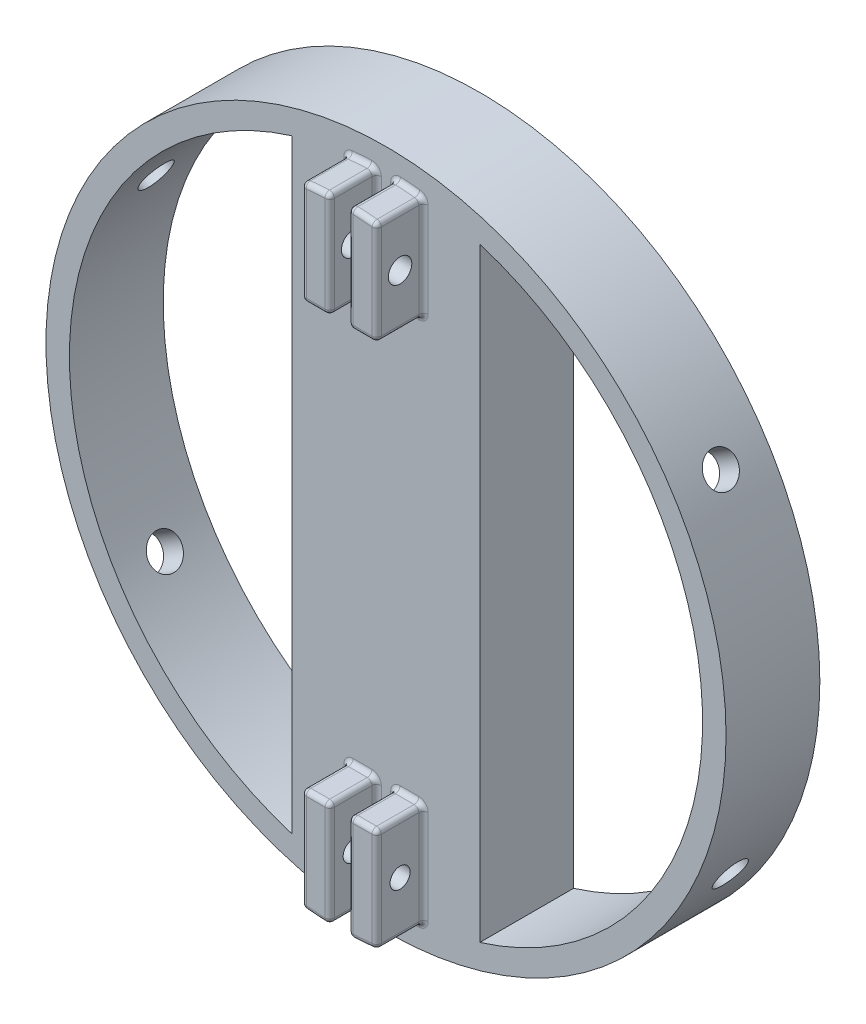
from build123d import *

# Parameters (mm, degrees)
SKETCH5_R           = 36.25
BOSS_EXTRUDE2_DEPTH = 10
CUT_EXTRUDE1_DEPTH  = 10
BOSS_EXTRUDE4_START = 5
BOSS_EXTRUDE4_DEPTH = 5
FILLET1_R           = 0.5
SKETCH8_R           = 1.75
CUT_EXTRUDE2_DEPTH  = 5
SKETCH9_R           = 1.75
CUT_EXTRUDE3_DEPTH  = 5
CUT_EXTRUDE4_START  = -5
SKETCH10_R          = 1.75
CUT_EXTRUDE4_DEPTH  = 5
CUT_EXTRUDE5_START  = -5
SKETCH11_R          = 1.75
CUT_EXTRUDE5_DEPTH  = 5
SKETCH12_R          = 1.25
CUT_EXTRUDE6_DEPTH  = 10
SKETCH13_R          = 1.067806031
CUT_EXTRUDE7_DEPTH  = 10


with BuildPart() as part:
    # Sketch5 → Boss-Extrude2 (new body)
    with BuildSketch(Plane.XY):
        Circle(SKETCH5_R)
    extrude(amount=BOSS_EXTRUDE2_DEPTH)

    # Sketch6 → Cut-Extrude1 (cut)
    with BuildSketch(Plane.XY.offset(10)):
        with BuildLine():
            ThreePointArc((10, -32.234492396), (33.75, 0), (10, 32.234492396))
            Line((10, 32.234492396), (10, -32.234492396))
        make_face()
        with BuildLine():
            Line((-10, -32.234492396), (-10, 32.234492396))
            ThreePointArc((-10, 32.234492396), (-33.75, 0), (-10, -32.234492396))
        make_face()
    extrude(amount=-CUT_EXTRUDE1_DEPTH, mode=Mode.SUBTRACT)

    # Sketch6<8> → Boss-Extrude4 (add)
    with BuildSketch(Plane.XY.offset(10).offset(BOSS_EXTRUDE4_START)):
        with BuildLine():
            Line((4, 22.5), (4, 33.512124672))
            ThreePointArc((4, 33.512124672), (2.502486491, 33.65709526), (1, 33.735181932))
            Line((1, 33.735181932), (1, 22.5))
            Line((1, 22.5), (4, 22.5))
        make_face()
        with BuildLine():
            ThreePointArc((-1, 33.735181932), (-2.502486491, 33.65709526), (-4, 33.512124672))
            Line((-4, 33.512124672), (-4, 22.5))
            Line((-4, 22.5), (-1, 22.5))
            Line((-1, 22.5), (-1, 33.735181932))
        make_face()
        with BuildLine():
            Line((-1, -22.5), (-4, -22.5))
            Line((-4, -22.5), (-4, -33.512124672))
            ThreePointArc((-4, -33.512124672), (-2.502486491, -33.65709526), (-1, -33.735181932))
            Line((-1, -33.735181932), (-1, -22.5))
        make_face()
        with BuildLine():
            Line((4, -22.5), (1, -22.5))
            Line((1, -22.5), (1, -33.735181932))
            ThreePointArc((1, -33.735181932), (2.502486491, -33.65709526), (4, -33.512124672))
            Line((4, -33.512124672), (4, -22.5))
        make_face()
    extrude(amount=-BOSS_EXTRUDE4_DEPTH)

    # Fillet1
    fillet1_edges = [part.edges().sort_by_distance(p)[0] for p in [
        (1, -28.117590966, 10),
        (1, 28.117590966, 10),
        (-1, 28.117590966, 10),
        (4, 28.006062336, 10),
        (-2.5, -22.5, 10),
        (1, -22.5, 12.5),
        (2.5, -22.5, 10),
        (-2.5, -22.5, 15),
        (-1, -28.117590966, 15),
        (-1, -22.5, 12.5),
        (-1, -28.117590966, 10),
        (2.5, -22.5, 15),
        (1, -28.117590966, 15),
        (4, -28.006062336, 15),
        (4, -22.5, 12.5),
        (4, -28.006062336, 10),
        (1, -33.735181932, 12.5),
        (2.502486491, -33.65709526, 15),
        (4, -33.512124672, 12.5),
        (2.502486491, -33.65709526, 10),
        (-2.502486491, -33.65709526, 15),
        (-1, -33.735181932, 12.5),
        (-2.502486491, -33.65709526, 10),
        (-4, -22.5, 12.5),
        (-4, -28.006062336, 15),
        (-4, -33.512124672, 12.5),
        (-4, -28.006062336, 10),
        (-1, 22.5, 12.5),
        (-2.5, 22.5, 10),
        (1, 22.5, 12.5),
        (4, 22.5, 12.5),
        (2.5, 22.5, 10),
        (-4, 22.5, 12.5),
        (-4, 28.006062336, 10),
        (4, 33.512124672, 12.5),
        (1, 33.735181932, 12.5),
        (2.502486491, 33.65709526, 10),
        (-1, 33.735181932, 12.5),
        (-4, 33.512124672, 12.5),
        (-2.502486491, 33.65709526, 10),
        (4, 28.006062336, 15),
        (2.5, 22.5, 15),
        (1, 28.117590966, 15),
        (2.502486491, 33.65709526, 15),
        (-2.5, 22.5, 15),
        (-4, 28.006062336, 15),
        (-2.502486491, 33.65709526, 15),
        (-1, 28.117590966, 15),
    ]]
    fillet(fillet1_edges, radius=FILLET1_R)

    # Sketch8 → Cut-Extrude2 (cut)
    with BuildSketch(Plane(origin=(31.703627103, -17.576761036, 0), x_dir=(0, 0, -1), z_dir=(0.8745828166294621, -0.484876166517263, 0))):
        with Locations((-5, 0)):
            Circle(SKETCH8_R)
    extrude(amount=-CUT_EXTRUDE2_DEPTH, mode=Mode.SUBTRACT)

    # Sketch9 → Cut-Extrude3 (cut)
    with BuildSketch(Plane(origin=(30.70285949, 19.271661037, 0), x_dir=(0, 0, -1), z_dir=(0.8469754342156529, 0.5316320286017447, 0))):
        with Locations((-5, 0)):
            Circle(SKETCH9_R)
    extrude(amount=-CUT_EXTRUDE3_DEPTH, mode=Mode.SUBTRACT)

    # Sketch10 → Cut-Extrude4 (cut)
    with BuildSketch(Plane(origin=(-31.703627103, 17.576761036, 0), x_dir=(0, 0, 1), z_dir=(-0.8745828166294618, 0.4848761665172636, 0)).offset(CUT_EXTRUDE4_START)):
        with Locations((5, 0)):
            Circle(SKETCH10_R)
    extrude(amount=CUT_EXTRUDE4_DEPTH, mode=Mode.SUBTRACT)

    # Sketch11 → Cut-Extrude5 (cut)
    with BuildSketch(Plane(origin=(-30.70285949, -19.271661037, 0), x_dir=(0, 0, 1), z_dir=(-0.8469754342156534, -0.5316320286017441, 0)).offset(CUT_EXTRUDE5_START)):
        with Locations((5, 0)):
            Circle(SKETCH11_R)
    extrude(amount=CUT_EXTRUDE5_DEPTH, mode=Mode.SUBTRACT)

    # Sketch12 → Cut-Extrude6 (cut)
    with BuildSketch(Plane(origin=(4, 0, 0), x_dir=(0, 0, -1), z_dir=(1, 0, 0))):
        with Locations((-12.5, 28.065276348)):
            Circle(SKETCH12_R)
    extrude(amount=-CUT_EXTRUDE6_DEPTH, mode=Mode.SUBTRACT)

    # Sketch13 → Cut-Extrude7 (cut)
    with BuildSketch(Plane(origin=(4, 0, 0), x_dir=(0, 0, -1), z_dir=(1, 0, 0))):
        with Locations((-12.5, -28)):
            Circle(SKETCH13_R)
    extrude(amount=-CUT_EXTRUDE7_DEPTH, mode=Mode.SUBTRACT)


solid = part.part
